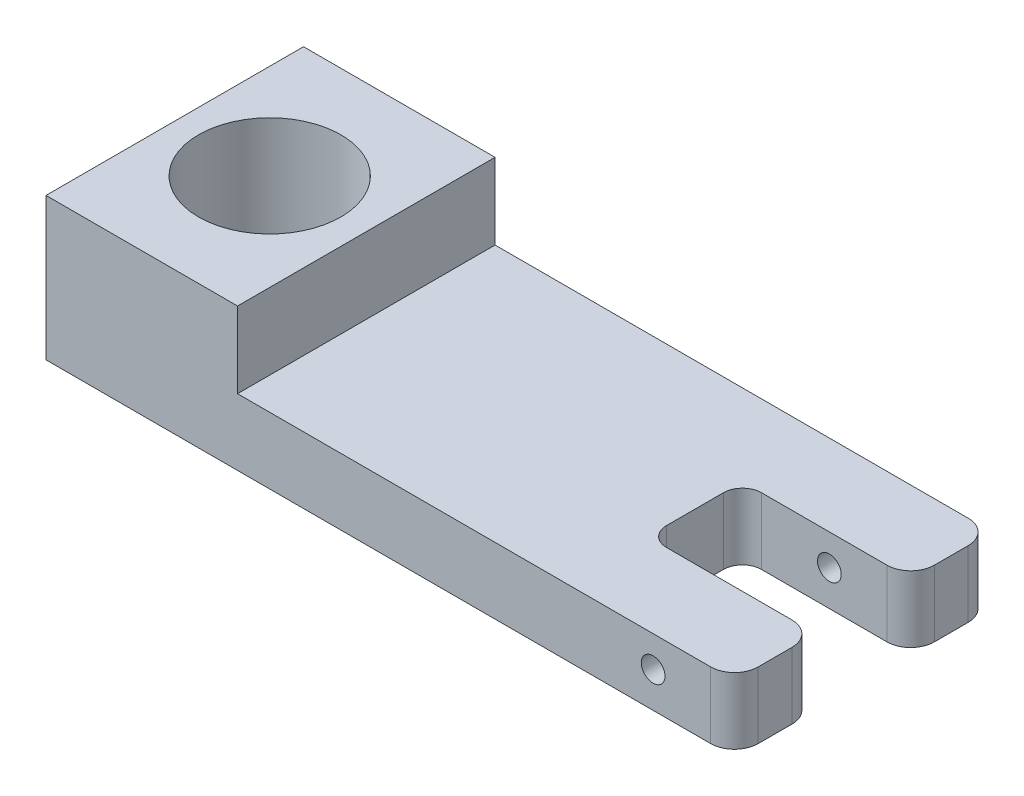
from build123d import *

# Parameters (mm, degrees)
SKETCH_1_W          = 145
SKETCH_1_H          = 54.239140964
SKETCH_1_R          = 15
EXTRUDE_1_DEPTH     = 14
CUT_EXTRUDE_1_DEPTH = 50
FILLET_2_R          = 5
SKETCH_3_R          = 2.5
CUT_EXTRUDE_2_DEPTH = 36
SKETCH_4_W          = 40.34248958
SKETCH_4_H          = 54.239140964
SKETCH_4_R          = 15
EXTRUDE_2_DEPTH     = 16


with BuildPart() as part:
    # Эскиз1 → Вытянуть1 (new body)
    with BuildSketch(Plane(origin=(0, 0, 0), x_dir=(1, 0, 0), z_dir=(0, 1, 0))):
        with Locations((52.5, 0)):
            Rectangle(SKETCH_1_W, SKETCH_1_H)
        with Locations(Location((0, 0, 0), (0, 0, 270))):
            Circle(SKETCH_1_R, mode=Mode.SUBTRACT)
    extrude(amount=EXTRUDE_1_DEPTH)

    # Эскиз2 → Вырез-Вытянуть1 (cut)
    with BuildSketch(Plane(origin=(0, 0, 0), x_dir=(1, 0, 0), z_dir=(0, 1, 0))):
        with BuildLine():
            Line((93.569014329, -10), (130.542559867, -10))
            Line((130.542559867, -10), (130.542559867, 10))
            Line((130.542559867, 10), (93.573862666, 10))
            ThreePointArc((93.573862666, 10), (90.74600698, 8.828998449), (89.573862992, 6.001616112))
            Line((89.573862992, 6.001616112), (89.569014656, -5.998383888))
            ThreePointArc((89.569014656, -5.998383888), (90.74001588, -8.827855685), (93.569014329, -10))
        make_face()
    extrude(amount=CUT_EXTRUDE_1_DEPTH, mode=Mode.SUBTRACT)

    # Скругление2
    fillet_2_edges = [part.edges().sort_by_distance(p)[0] for p in [
        (125, 7, 10),
        (125, 7, -10),
        (125, 7, 27.119570482),
        (125, 7, -27.119570482),
    ]]
    fillet(fillet_2_edges, radius=FILLET_2_R)

    # Эскиз3 → Вырез-Вытянуть2 (cut, symmetric)
    with BuildSketch(Plane.XY):
        with Locations(Location((107.871367235, 7.461129595, 0), (0, 0, 180))):
            Circle(SKETCH_3_R)
    extrude(amount=CUT_EXTRUDE_2_DEPTH, both=True, mode=Mode.SUBTRACT)

    # Эскиз4 → Вытянуть2 (add)
    with BuildSketch(Plane(origin=(0, 14, 0), x_dir=(1, 0, 0), z_dir=(0, 1, 0))):
        with Locations((0.17124479, 0)):
            Rectangle(SKETCH_4_W, SKETCH_4_H)
        with Locations(Location((0, 0, 0), (0, 0, 270))):
            Circle(SKETCH_4_R, mode=Mode.SUBTRACT)
    extrude(amount=EXTRUDE_2_DEPTH)


solid = part.part
